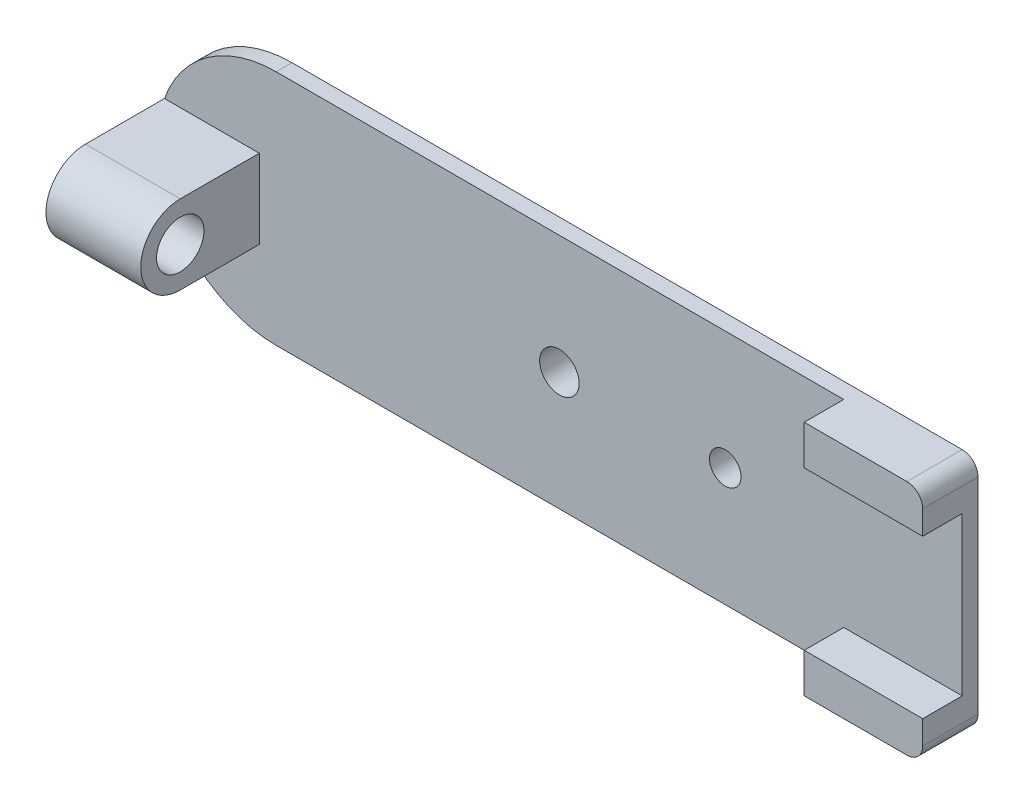
from build123d import *

# Parameters (mm, degrees)
BASE_EXTRUSION_DEPTH    = 4
ESQUISSE2_W             = 30
ESQUISSE2_H             = 10
BOSS_EXTRU_1_DEPTH      = 10
ESQUISSE3_R             = 8
ESQUISSE3_R_2           = 9
BOSS_EXTRU_2_DEPTH      = 4
ESQUISSE4_R             = 4
ENL_V_MAT_EXTRU_1_DEPTH = 178.20370881
ESQUISSE5_R             = 5
ENL_V_MAT_EXTRU_2_DEPTH = 178.20370881
CONG_1_R                = 2
CONG_2_R                = 4
ESQUISSE6_R             = 6
BOSS_EXTRU_3_DEPTH      = 24
ESQUISSE7_R             = 9
ESQUISSE7_R_2           = 5
BOSS_EXTRU_4_DEPTH      = 10


with BuildPart() as part:
    # Esquisse1 → Base-Extrusion (new body)
    with BuildSketch(Plane.XY):
        with BuildLine():
            Line((0, 30), (173.715728753, 30))
            Line((173.715728753, 30), (173.715728753, -30))
            Line((173.715728753, -30), (0, -30))
            ThreePointArc((0, -30), (-17.320508076, -24.494897428), (-28.284271247, -10))
            Line((-28.284271247, -10), (-28.284271247, 10))
            ThreePointArc((-28.284271247, 10), (-17.320508076, 24.494897428), (0, 30))
        make_face()
    extrude(amount=BASE_EXTRUSION_DEPTH)

    # Esquisse2 → Boss.-Extru.1 (add)
    with BuildSketch(Plane.XY.offset(4)):
        with Locations((158.715728753, 25)):
            Rectangle(ESQUISSE2_W, ESQUISSE2_H)
        with Locations((158.715728753, -25)):
            Rectangle(ESQUISSE2_W, ESQUISSE2_H)
    extrude(amount=BOSS_EXTRU_1_DEPTH)

    # Esquisse3 → Boss.-Extru.2 (add)
    with BuildSketch(Plane(origin=(0, 0, 0), x_dir=(-1, 0, 0), z_dir=(0, 0, -1))):
        with Locations(Location((-113.715728753, 0, 0), (0, 0, 180))):
            Circle(ESQUISSE3_R)
        with Locations(Location((-71.715728753, 0, 0), (0, 0, 180))):
            Circle(ESQUISSE3_R_2)
    extrude(amount=BOSS_EXTRU_2_DEPTH)

    # Esquisse4 → Enlèv. mat.-Extru.1 (cut, through all)
    with BuildSketch(Plane(origin=(0, 0, -4), x_dir=(-1, 0, 0), z_dir=(0, 0, -1))):
        with Locations((-113.715728753, 0)):
            Circle(ESQUISSE4_R)
    extrude(amount=-ENL_V_MAT_EXTRU_1_DEPTH, mode=Mode.SUBTRACT)

    # Esquisse5 → Enlèv. mat.-Extru.2 (cut, through all)
    with BuildSketch(Plane(origin=(0, 0, -4), x_dir=(-1, 0, 0), z_dir=(0, 0, -1))):
        with Locations((-71.715728753, 0)):
            Circle(ESQUISSE5_R)
    extrude(amount=-ENL_V_MAT_EXTRU_2_DEPTH, mode=Mode.SUBTRACT)

    # Congé1
    cong_1_edges = [part.edges().sort_by_distance(p)[0] for p in [
        (105.715728753, 0, 0),
        (62.715728753, 0, 0),
    ]]
    fillet(cong_1_edges, radius=CONG_1_R)

    # Congé2
    cong_2_edges = [part.edges().sort_by_distance(p)[0] for p in [
        (173.715728753, 30, 7),
        (173.715728753, -30, 7),
    ]]
    fillet(cong_2_edges, radius=CONG_2_R)

    # Esquisse6 → Boss.-Extru.3 (add)
    with BuildSketch(Plane.ZY.offset(28.284271247)):
        with BuildLine():
            Line((0, 10), (24, 10))
            ThreePointArc((24, 10), (34, 0), (24, -10))
            Line((24, -10), (0, -10))
            Line((0, -10), (0, 10))
        make_face()
        with Locations((24, 0)):
            Circle(ESQUISSE6_R, mode=Mode.SUBTRACT)
    extrude(amount=-BOSS_EXTRU_3_DEPTH)

    # Esquisse7 → Boss.-Extru.4 (add)
    with BuildSketch(Plane(origin=(0, 0, -4), x_dir=(-1, 0, 0), z_dir=(0, 0, -1))):
        with Locations(Location((-71.715728753, 0, 0), (0, 0, 180))):
            Circle(ESQUISSE7_R)
        with Locations((-71.715728753, 0)):
            Circle(ESQUISSE7_R_2, mode=Mode.SUBTRACT)
    extrude(amount=BOSS_EXTRU_4_DEPTH)


solid = part.part
